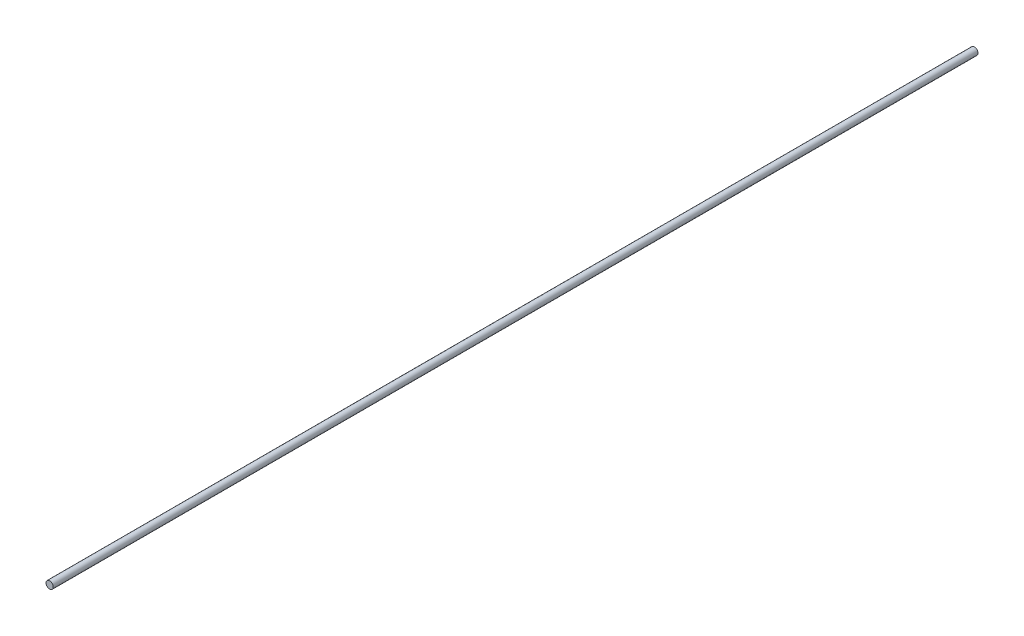
from build123d import *

# Parameters (mm, degrees)
SKETCH1_R           = 1.984375
BOSS_EXTRUDE1_DEPTH = 508


with BuildPart() as part:
    # Sketch1 → Boss-Extrude1 (new body)
    with BuildSketch(Plane.XY):
        Circle(SKETCH1_R)
    extrude(amount=BOSS_EXTRUDE1_DEPTH)


solid = part.part
